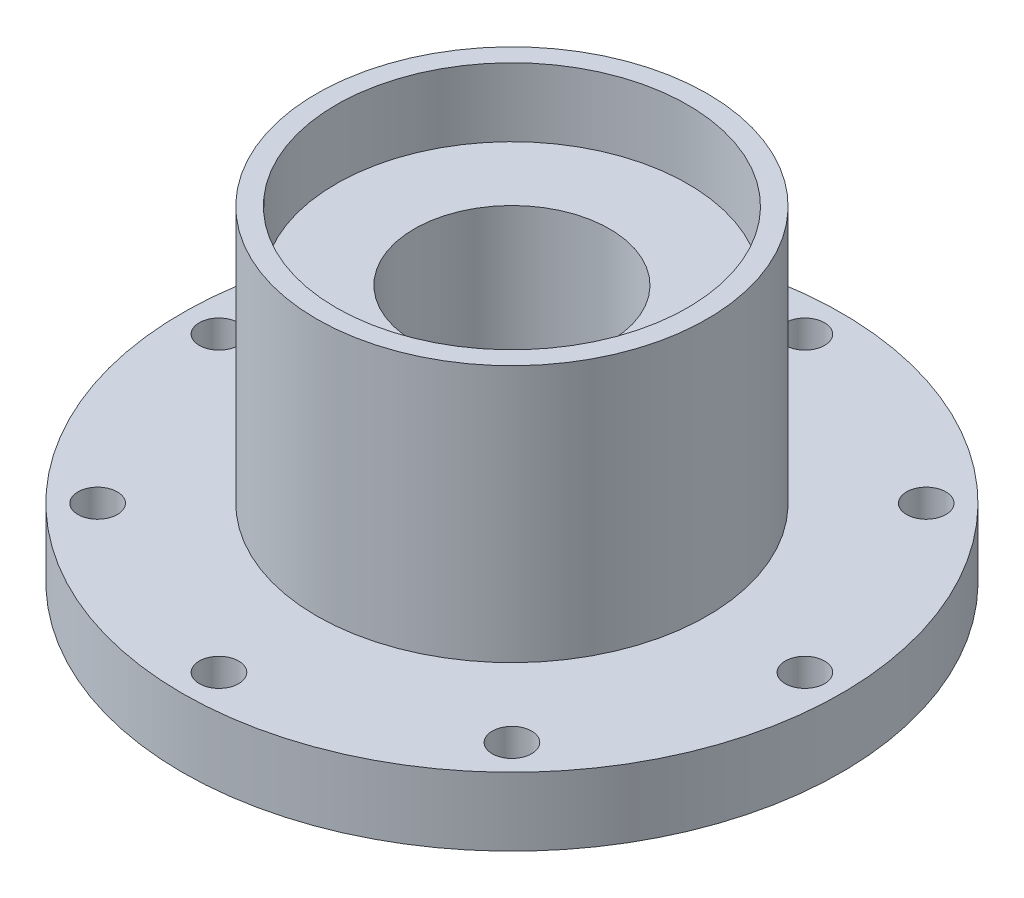
from build123d import *

# Parameters (mm, degrees)
CUT_EXTRUDE1_DEPTH      = 164.536310953
CUT_EXTRUDE1_DEPTH_BACK = 164.536310953
SKETCH2_R               = 6.05
SCALE1_SCALE            = 0.25


with BuildPart() as part:
    # Sketch1 → Revolve1 (revolve)
    with BuildSketch(Plane(origin=(0, 0, 0), x_dir=(0, 0, -1), z_dir=(1, 0, 0))):
        Polygon((-60, -15.260894059), (-60, -94.260894059), (-101.25, -94.260894059), (-101.25, -107.260894059), (-101.25, -115.260894059), (-54, -115.260894059), (-54, -94.260894059), (-34.1, -94.260894059), (-30, -94.160894059), (-30, -36.260894059), (-54, -36.260894059), (-54, -15.260894059), align=None)
    revolve(axis=Axis((0, 150, 0), (0, -1, 0)))

    # Sketch2 → Cut-Extrude1 (cut, two sides: drawn at the far end of the back side and taken through both)
    with BuildSketch(Plane(origin=(0, -94.260894059, 0), x_dir=(1, 0, 0), z_dir=(0, 1, 0)).offset(-CUT_EXTRUDE1_DEPTH_BACK)):
        with Locations(Location((0, 90, 0), (0, 0, 270))):
            Circle(SKETCH2_R)
        with Locations(Location((63.639610307, 63.639610307, 0), (0, 0, 270))):
            Circle(SKETCH2_R)
        with Locations(Location((90, 0, 0), (0, 0, 270))):
            Circle(SKETCH2_R)
        with Locations(Location((63.639610307, -63.639610307, 0), (0, 0, 270))):
            Circle(SKETCH2_R)
        with Locations(Location((0, -90, 0), (0, 0, 270))):
            Circle(SKETCH2_R)
        with Locations(Location((-63.639610307, -63.639610307, 0), (0, 0, 270))):
            Circle(SKETCH2_R)
        with Locations(Location((-90, 0, 0), (0, 0, 270))):
            Circle(SKETCH2_R)
        with Locations(Location((-63.639610307, 63.639610307, 0), (0, 0, 270))):
            Circle(SKETCH2_R)
    extrude(amount=CUT_EXTRUDE1_DEPTH + CUT_EXTRUDE1_DEPTH_BACK, mode=Mode.SUBTRACT)


with BuildPart() as part_1:
    # Scale1: scaled about (0, -81.802293933, 0)
    add(part.part.scale(SCALE1_SCALE).moved(Location((0, -61.35172045, 0))))


solid = part_1.part
